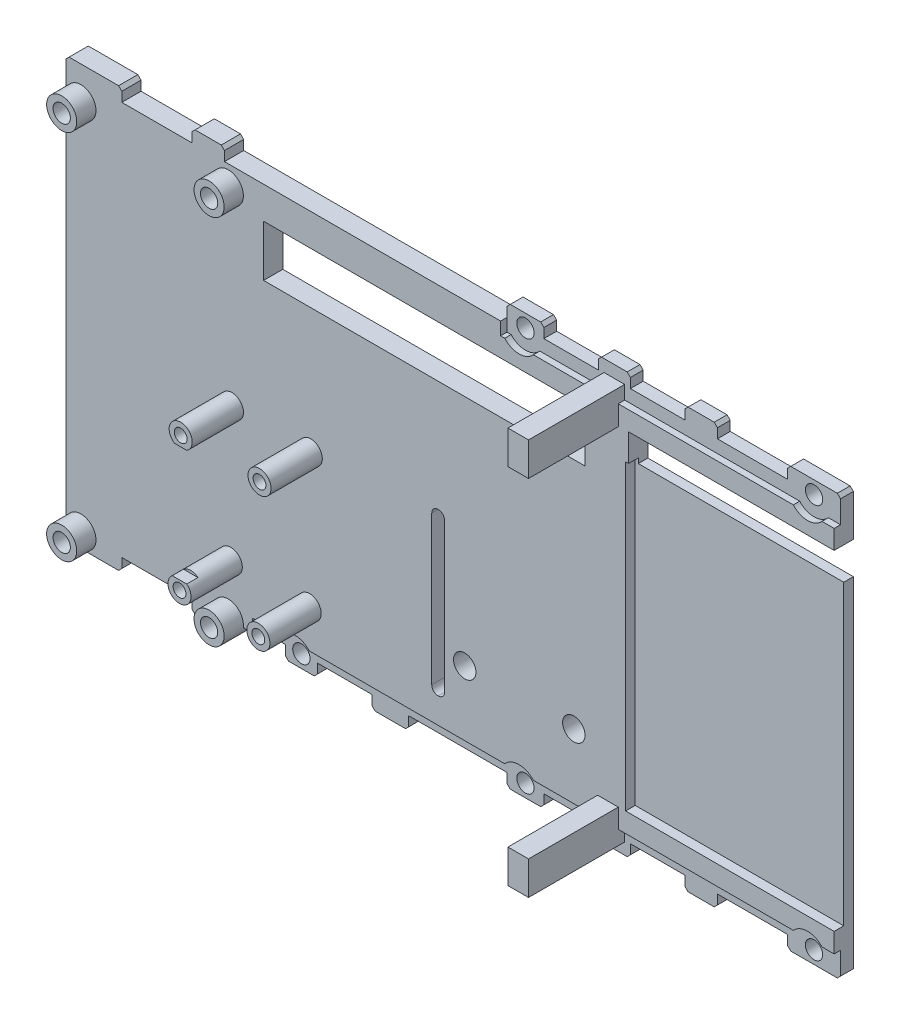
from build123d import *

# Parameters (mm, degrees)
SKETCH1_R           = 1.35
BOSS_EXTRUDE1_DEPTH = 3
SKETCH2_W           = 32.539262004
SKETCH2_H           = 47.2
CUT_EXTRUDE1_DEPTH  = 1.5
CUT_EXTRUDE2_DEPTH  = 1
SKETCH4_W           = 39.18
SKETCH4_H           = 5.04
CUT_EXTRUDE3_DEPTH  = 3
BOSS_EXTRUDE3_START = -1
SKETCH5_W           = 3.213705867
SKETCH5_H           = 5.217642876
BOSS_EXTRUDE3_DEPTH = 15
SKETCH6_R           = 2.35
BOSS_EXTRUDE4_DEPTH = 6
SKETCH7_R           = 1.35
CUT_EXTRUDE4_DEPTH  = 3
SKETCH8_R           = 1.799931462
BOSS_EXTRUDE5_DEPTH = 8
SKETCH9_R           = 1
CUT_EXTRUDE5_DEPTH  = 11
CUT_EXTRUDE6_DEPTH  = 3
SKETCH11_W          = 50.12494376
SKETCH11_H          = 8
CUT_EXTRUDE7_DEPTH  = 3
SKETCH12_W          = 2.262523605
SKETCH12_H          = 18.069154429
CUT_EXTRUDE8_DEPTH  = 1.75
SKETCH13_R          = 1.75
CUT_EXTRUDE9_DEPTH  = 3


with BuildPart() as part:
    # Sketch1 → Boss-Extrude1 (new body)
    with BuildSketch(Plane.XY):
        Polygon((59.70625, -28.75), (59.70625, -32.25), (59.20625, -32.75), (51.936987996, -32.75), (51.436987996, -32.25), (51.436987996, -30.75), (40.496987996, -30.75), (40.496987996, -32.25), (39.996987996, -32.75), (35.916987996, -32.75), (35.416987996, -32.25), (35.416987996, -30.75), (26.916987996, -30.75), (26.916987996, -32.25), (26.416987996, -32.75), (22.416987996, -32.75), (21.916987996, -32.25), (21.916987996, -30.75), (13.416987996, -30.75), (13.416987996, -32.25), (12.916987996, -32.75), (8.166987996, -32.75), (7.666987996, -32.25), (7.666987996, -30.75), (-7.666987996, -30.75), (-7.666987996, -32.25), (-8.166987996, -32.75), (-12.916987996, -32.75), (-13.416987996, -32.25), (-13.416987996, -30.75), (-21.916987996, -30.75), (-21.916987996, -32.25), (-22.416987996, -32.75), (-26.416987996, -32.75), (-26.916987996, -32.25), (-26.916987996, -30.75), (-35.416987996, -30.75), (-35.416987996, -32.25), (-35.916987996, -32.75), (-39.996987996, -32.75), (-40.496987996, -32.25), (-40.496987996, -30.75), (-51.436987996, -30.75), (-51.436987996, -32.25), (-51.936987996, -32.75), (-59.663932929, -32.75), (-60.163932929, -32.25), (-60.163932929, 32.25), (-59.663932929, 32.75), (-51.936987996, 32.75), (-51.436987996, 32.25), (-51.436987996, 30.75), (-40.496987996, 30.75), (-40.496987996, 32.25), (-39.996987996, 32.75), (-35.916987996, 32.75), (-35.416987996, 32.25), (-35.416987996, 30.75), (7.666987996, 30.75), (7.666987996, 32.25), (8.166987996, 32.75), (12.916987996, 32.75), (13.416987996, 32.25), (13.416987996, 30.75), (21.916987996, 30.75), (21.916987996, 32.25), (22.416987996, 32.75), (26.416987996, 32.75), (26.916987996, 32.25), (26.916987996, 30.75), (35.416987996, 30.75), (35.416987996, 32.25), (35.916987996, 32.75), (39.996987996, 32.75), (40.496987996, 32.25), (40.496987996, 30.75), (51.436987996, 30.75), (51.436987996, 32.25), (51.936987996, 32.75), (59.20625, 32.75), (59.70625, 32.25), (59.70625, 28.75), align=None)
        with Locations((10.545756529, 30.750001775)):
            Circle(SKETCH1_R, mode=Mode.SUBTRACT)
        with Locations((55.575387531, 30.750001775)):
            Circle(SKETCH1_R, mode=Mode.SUBTRACT)
        with Locations((55.571618998, -30.75)):
            Circle(SKETCH1_R, mode=Mode.SUBTRACT)
        with Locations((10.541987996, -30.75)):
            Circle(SKETCH1_R, mode=Mode.SUBTRACT)
        with Locations((-24.416987996, -30.75)):
            Circle(SKETCH1_R, mode=Mode.SUBTRACT)
    extrude(amount=BOSS_EXTRUDE1_DEPTH)

    # Sketch2 → Cut-Extrude1 (cut)
    with BuildSketch(Plane.XY.offset(3)):
        with Locations((43.436618998, -2.1)):
            Rectangle(SKETCH2_W, SKETCH2_H)
    extrude(amount=-CUT_EXTRUDE1_DEPTH, mode=Mode.SUBTRACT)

    # Sketch3 → Cut-Extrude2 (cut)
    with BuildSketch(Plane.XY.offset(3)):
        with BuildLine():
            Line((7.666987996, 28.75), (8.309690139, 28.75))
            ThreePointArc((8.309690139, 28.75), (10.545756529, 27.750001775), (12.781822919, 28.75))
            Line((12.781822919, 28.75), (53.339321141, 28.75))
            ThreePointArc((53.339321141, 28.75), (55.575387531, 27.750001775), (57.811453921, 28.75))
            Line((57.811453921, 28.75), (59.70625, 28.75))
            Line((59.70625, 28.75), (59.70625, 32.75))
            Line((59.70625, 32.75), (7.666987996, 32.75))
            Line((7.666987996, 32.75), (7.666987996, 28.75))
        make_face()
        with BuildLine():
            Line((-31.069252348, -28.75), (-26.653055973, -28.75))
            ThreePointArc((-26.653055973, -28.75), (-24.416987996, -27.75), (-22.180920018, -28.75))
            Line((-22.180920018, -28.75), (8.305920018, -28.75))
            ThreePointArc((8.305920018, -28.75), (10.541987996, -27.75), (12.778055973, -28.75))
            Line((12.778055973, -28.75), (53.33555102, -28.75))
            ThreePointArc((53.33555102, -28.75), (55.571618998, -27.75), (57.807686975, -28.75))
            Line((57.807686975, -28.75), (59.70625, -28.75))
            Line((59.70625, -28.75), (59.70625, -32.75))
            Line((59.70625, -32.75), (-22.180920018, -32.75))
            ThreePointArc((-22.180920018, -32.75), (-24.416987996, -33.75), (-26.653055973, -32.75))
            Line((-26.653055973, -32.75), (-31.069252348, -32.75))
            Line((-31.069252348, -32.75), (-31.069252348, -28.75))
        make_face()
    extrude(amount=-CUT_EXTRUDE2_DEPTH, mode=Mode.SUBTRACT)

    # Sketch4 → Cut-Extrude3 (cut)
    with BuildSketch(Plane.XY.offset(3)):
        with Locations((47.236987996, 23.25)):
            Rectangle(SKETCH4_W, SKETCH4_H)
    extrude(amount=-CUT_EXTRUDE3_DEPTH, mode=Mode.SUBTRACT)

    # Sketch5 → Boss-Extrude3 (add)
    with BuildSketch(Plane.XY.offset(3).offset(BOSS_EXTRUDE3_START)):
        with Locations((24.416987996, -28.358821438)):
            Rectangle(SKETCH5_W, SKETCH5_H)
        with Locations((24.416987996, 28.258821438)):
            Rectangle(SKETCH5_W, SKETCH5_H)
    extrude(amount=BOSS_EXTRUDE3_DEPTH)

    # Sketch6 → Boss-Extrude4 (add)
    with BuildSketch(Plane(origin=(0, 0, 0), x_dir=(-1, 0, 0), z_dir=(0, 0, -1))):
        with Locations((57.813932929, -30.4)):
            Circle(SKETCH6_R)
        with Locations((34.814808698, -30.4)):
            Circle(SKETCH6_R)
        with Locations((34.814808698, 27.597791538)):
            Circle(SKETCH6_R)
        with Locations((57.813932929, 27.597791538)):
            Circle(SKETCH6_R)
    extrude(amount=-BOSS_EXTRUDE4_DEPTH)

    # Sketch7 → Cut-Extrude4 (cut)
    with BuildSketch(Plane.XY.offset(6)):
        with Locations((-57.813932929, 27.597791538)):
            Circle(SKETCH7_R)
        with Locations((-34.814808698, 27.597791538)):
            Circle(SKETCH7_R)
        with Locations((-34.814808698, -30.4)):
            Circle(SKETCH7_R)
        with Locations((-57.813932929, -30.4)):
            Circle(SKETCH7_R)
    extrude(amount=-CUT_EXTRUDE4_DEPTH, mode=Mode.SUBTRACT)

    # Sketch8 → Boss-Extrude5 (add)
    with BuildSketch(Plane.XY.offset(3)):
        with Locations(Location((-34.249007268, -1.671088179, 0), (0, 0, 180))):
            Circle(SKETCH8_R)
        with Locations(Location((-21.949943943, -1.778420479, 0), (0, 0, 180))):
            Circle(SKETCH8_R)
        with Locations(Location((-22.124474985, -22.777697016, 0), (0, 0, 180))):
            Circle(SKETCH8_R)
        with Locations(Location((-34.432264513, -22.670288564, 0), (0, 0, 180))):
            Circle(SKETCH8_R)
    extrude(amount=BOSS_EXTRUDE5_DEPTH)

    # Sketch9 → Cut-Extrude5 (cut)
    with BuildSketch(Plane.XY.offset(11)):
        with Locations((-34.432264513, -22.670288564)):
            Circle(SKETCH9_R)
        with Locations((-22.133201188, -22.777620863)):
            Circle(SKETCH9_R)
        with Locations((-34.249007268, -1.671088179)):
            Circle(SKETCH9_R)
        with Locations((-21.949943943, -1.778420479)):
            Circle(SKETCH9_R)
    extrude(amount=-CUT_EXTRUDE5_DEPTH, mode=Mode.SUBTRACT)

    # Sketch10 → Cut-Extrude6 (cut)
    with BuildSketch(Plane.XY.offset(3)):
        with BuildLine():
            Line((-2.078617038, -24.770288564), (-2.068617038, -24.770288564))
            ThreePointArc((-2.068617038, -24.770288564), (-1.361510257, -24.477395345), (-1.068617038, -23.770288564))
            Line((-1.068617038, -23.770288564), (-1.068617038, -0.570288564))
            ThreePointArc((-1.068617038, -0.570288564), (-1.361510257, 0.136818218), (-2.068617038, 0.429711436))
            Line((-2.068617038, 0.429711436), (-2.078617038, 0.429711436))
            ThreePointArc((-2.078617038, 0.429711436), (-2.785723819, 0.136818218), (-3.078617038, -0.570288564))
            Line((-3.078617038, -0.570288564), (-3.078617038, -23.770288564))
            ThreePointArc((-3.078617038, -23.770288564), (-2.785723819, -24.477395345), (-2.078617038, -24.770288564))
        make_face()
    extrude(amount=-CUT_EXTRUDE6_DEPTH, mode=Mode.SUBTRACT)

    # Sketch11 → Cut-Extrude7 (cut)
    with BuildSketch(Plane.XY.offset(3)):
        with Locations((-4.252336818, 21.750001775)):
            Rectangle(SKETCH11_W, SKETCH11_H)
    extrude(amount=-CUT_EXTRUDE7_DEPTH, mode=Mode.SUBTRACT)

    # Sketch12 → Cut-Extrude8 (cut)
    with BuildSketch(Plane.XY.offset(11)):
        with Locations((-34.432264514, -12.23571135)):
            Rectangle(SKETCH12_W, SKETCH12_H)
    extrude(amount=-CUT_EXTRUDE8_DEPTH, mode=Mode.SUBTRACT)

    # Sketch13 → Cut-Extrude9 (cut)
    with BuildSketch(Plane.XY.offset(3)):
        with Locations((19.092279678, -18.65)):
            Circle(SKETCH13_R)
        with Locations((2.066987996, -18.65)):
            Circle(SKETCH13_R)
    extrude(amount=-CUT_EXTRUDE9_DEPTH, mode=Mode.SUBTRACT)


solid = part.part
